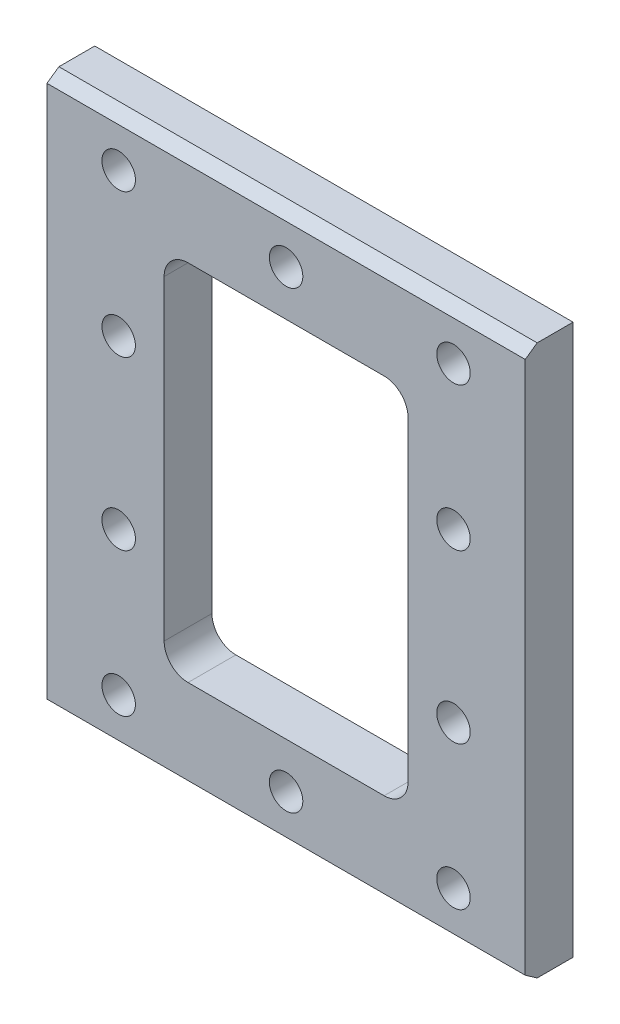
from build123d import *
from OCP.BRepFilletAPI import BRepFilletAPI_MakeChamfer

# Parameters (mm, degrees)
SKETCH_1_W          = 200
SKETCH_1_H          = 230
EXTRUDE_1_DEPTH     = 20
CUT_EXTRUDE_1_REACH = 155.704
SKETCH_2_R          = 7
CHAMFER_1_SIZE      = 5
CHAMFER_1_SIZE2     = 3.501037691


with BuildPart() as part:
    # 草图1 → 凸台-拉伸1 (new body)
    with BuildSketch(Plane.XY):
        Rectangle(SKETCH_1_W, SKETCH_1_H)
    extrude(amount=EXTRUDE_1_DEPTH)

    # 草图2 → 切除-拉伸1 (cut, up to next)
    with BuildSketch(Plane.XY.offset(20), mode=Mode.PRIVATE) as cut_extrude_1_sk1:
        with Locations((-70, 95)):
            Circle(SKETCH_2_R)
    cut_extrude_1_tool1 = extrude(cut_extrude_1_sk1.sketch, amount=-CUT_EXTRUDE_1_REACH, mode=Mode.PRIVATE) & part.part
    # 草图2 → 切除-拉伸1 (cut, up to next)
    with BuildSketch(Plane.XY.offset(20), mode=Mode.PRIVATE) as cut_extrude_1_sk2:
        with Locations((0, 95)):
            Circle(SKETCH_2_R)
    cut_extrude_1_tool2 = extrude(cut_extrude_1_sk2.sketch, amount=-CUT_EXTRUDE_1_REACH, mode=Mode.PRIVATE) & part.part
    # 草图2 → 切除-拉伸1 (cut, up to next)
    with BuildSketch(Plane.XY.offset(20), mode=Mode.PRIVATE) as cut_extrude_1_sk3:
        with Locations((70, 95)):
            Circle(SKETCH_2_R)
    cut_extrude_1_tool3 = extrude(cut_extrude_1_sk3.sketch, amount=-CUT_EXTRUDE_1_REACH, mode=Mode.PRIVATE) & part.part
    # 草图2 → 切除-拉伸1 (cut, up to next)
    with BuildSketch(Plane.XY.offset(20), mode=Mode.PRIVATE) as cut_extrude_1_sk4:
        with Locations((-70, 35)):
            Circle(SKETCH_2_R)
    cut_extrude_1_tool4 = extrude(cut_extrude_1_sk4.sketch, amount=-CUT_EXTRUDE_1_REACH, mode=Mode.PRIVATE) & part.part
    # 草图2 → 切除-拉伸1 (cut, up to next)
    with BuildSketch(Plane.XY.offset(20), mode=Mode.PRIVATE) as cut_extrude_1_sk5:
        with Locations((70, 35)):
            Circle(SKETCH_2_R)
    cut_extrude_1_tool5 = extrude(cut_extrude_1_sk5.sketch, amount=-CUT_EXTRUDE_1_REACH, mode=Mode.PRIVATE) & part.part
    # 草图2 → 切除-拉伸1 (cut, up to next)
    with BuildSketch(Plane.XY.offset(20), mode=Mode.PRIVATE) as cut_extrude_1_sk6:
        with Locations((-70, -35)):
            Circle(SKETCH_2_R)
    cut_extrude_1_tool6 = extrude(cut_extrude_1_sk6.sketch, amount=-CUT_EXTRUDE_1_REACH, mode=Mode.PRIVATE) & part.part
    # 草图2 → 切除-拉伸1 (cut, up to next)
    with BuildSketch(Plane.XY.offset(20), mode=Mode.PRIVATE) as cut_extrude_1_sk7:
        with Locations((0, -95)):
            Circle(SKETCH_2_R)
    cut_extrude_1_tool7 = extrude(cut_extrude_1_sk7.sketch, amount=-CUT_EXTRUDE_1_REACH, mode=Mode.PRIVATE) & part.part
    # 草图2 → 切除-拉伸1 (cut, up to next)
    with BuildSketch(Plane.XY.offset(20), mode=Mode.PRIVATE) as cut_extrude_1_sk8:
        with Locations((-70, -95)):
            Circle(SKETCH_2_R)
    cut_extrude_1_tool8 = extrude(cut_extrude_1_sk8.sketch, amount=-CUT_EXTRUDE_1_REACH, mode=Mode.PRIVATE) & part.part
    # 草图2 → 切除-拉伸1 (cut, up to next)
    with BuildSketch(Plane.XY.offset(20), mode=Mode.PRIVATE) as cut_extrude_1_sk9:
        with Locations((70, -35)):
            Circle(SKETCH_2_R)
    cut_extrude_1_tool9 = extrude(cut_extrude_1_sk9.sketch, amount=-CUT_EXTRUDE_1_REACH, mode=Mode.PRIVATE) & part.part
    # 草图2 → 切除-拉伸1 (cut, up to next)
    with BuildSketch(Plane.XY.offset(20), mode=Mode.PRIVATE) as cut_extrude_1_sk10:
        with Locations((70, -95)):
            Circle(SKETCH_2_R)
    cut_extrude_1_tool10 = extrude(cut_extrude_1_sk10.sketch, amount=-CUT_EXTRUDE_1_REACH, mode=Mode.PRIVATE) & part.part
    # 草图2 → 切除-拉伸1 (cut, up to next)
    with BuildSketch(Plane.XY.offset(20), mode=Mode.PRIVATE) as cut_extrude_1_sk11:
        with BuildLine():
            Line((-41, 76), (41, 76))
            ThreePointArc((41, 76), (48.071067812, 73.071067812), (51, 66))
            Line((51, 66), (51, -66))
            ThreePointArc((51, -66), (48.071067812, -73.071067812), (41, -76))
            Line((41, -76), (-41, -76))
            ThreePointArc((-41, -76), (-48.071067812, -73.071067812), (-51, -66))
            Line((-51, -66), (-51, 66))
            ThreePointArc((-51, 66), (-48.071067812, 73.071067812), (-41, 76))
        make_face()
    cut_extrude_1_tool11 = extrude(cut_extrude_1_sk11.sketch, amount=-CUT_EXTRUDE_1_REACH, mode=Mode.PRIVATE) & part.part
    add(cut_extrude_1_tool1.solids().sort_by_distance((-70, 95, 20))[0], mode=Mode.SUBTRACT)
    add(cut_extrude_1_tool2.solids().sort_by_distance((0, 95, 20))[0], mode=Mode.SUBTRACT)
    add(cut_extrude_1_tool3.solids().sort_by_distance((70, 95, 20))[0], mode=Mode.SUBTRACT)
    add(cut_extrude_1_tool4.solids().sort_by_distance((-70, 35, 20))[0], mode=Mode.SUBTRACT)
    add(cut_extrude_1_tool5.solids().sort_by_distance((70, 35, 20))[0], mode=Mode.SUBTRACT)
    add(cut_extrude_1_tool6.solids().sort_by_distance((-70, -35, 20))[0], mode=Mode.SUBTRACT)
    add(cut_extrude_1_tool7.solids().sort_by_distance((0, -95, 20))[0], mode=Mode.SUBTRACT)
    add(cut_extrude_1_tool8.solids().sort_by_distance((-70, -95, 20))[0], mode=Mode.SUBTRACT)
    add(cut_extrude_1_tool9.solids().sort_by_distance((70, -35, 20))[0], mode=Mode.SUBTRACT)
    add(cut_extrude_1_tool10.solids().sort_by_distance((70, -95, 20))[0], mode=Mode.SUBTRACT)
    add(cut_extrude_1_tool11.solids().sort_by_distance((0, 0, 20))[0], mode=Mode.SUBTRACT)

    # 倒角1: one chamfer whose edges measure the first distance from different faces: ONE call of the kernel's chamfer builder (chamfer() names one face for all edges)
    chamfer_1_edges_1 = [part.edges().sort_by_distance(p)[0] for p in [
        (0, -115, 20),
    ]]
    chamfer_1_side_1 = [part.faces().sort_by_distance(p)[0] for p in [
        (0, -115, 10),
    ]]
    chamfer_1_edges_2 = [part.edges().sort_by_distance(p)[0] for p in [
        (0, 115, 20),
    ]]
    chamfer_1_side_2 = [part.faces().sort_by_distance(p)[0] for p in [
        (0, 115, 10),
    ]]
    chamfer_1 = BRepFilletAPI_MakeChamfer(part.part.solid().wrapped)
    for e in chamfer_1_edges_1:
        chamfer_1.Add(CHAMFER_1_SIZE, CHAMFER_1_SIZE2, e.wrapped, chamfer_1_side_1[0].wrapped)  # the first distance lies on this face
    for e in chamfer_1_edges_2:
        chamfer_1.Add(CHAMFER_1_SIZE, CHAMFER_1_SIZE2, e.wrapped, chamfer_1_side_2[0].wrapped)  # the first distance lies on this face
    add(Compound.cast(chamfer_1.Shape()), mode=Mode.REPLACE)


solid = part.part
